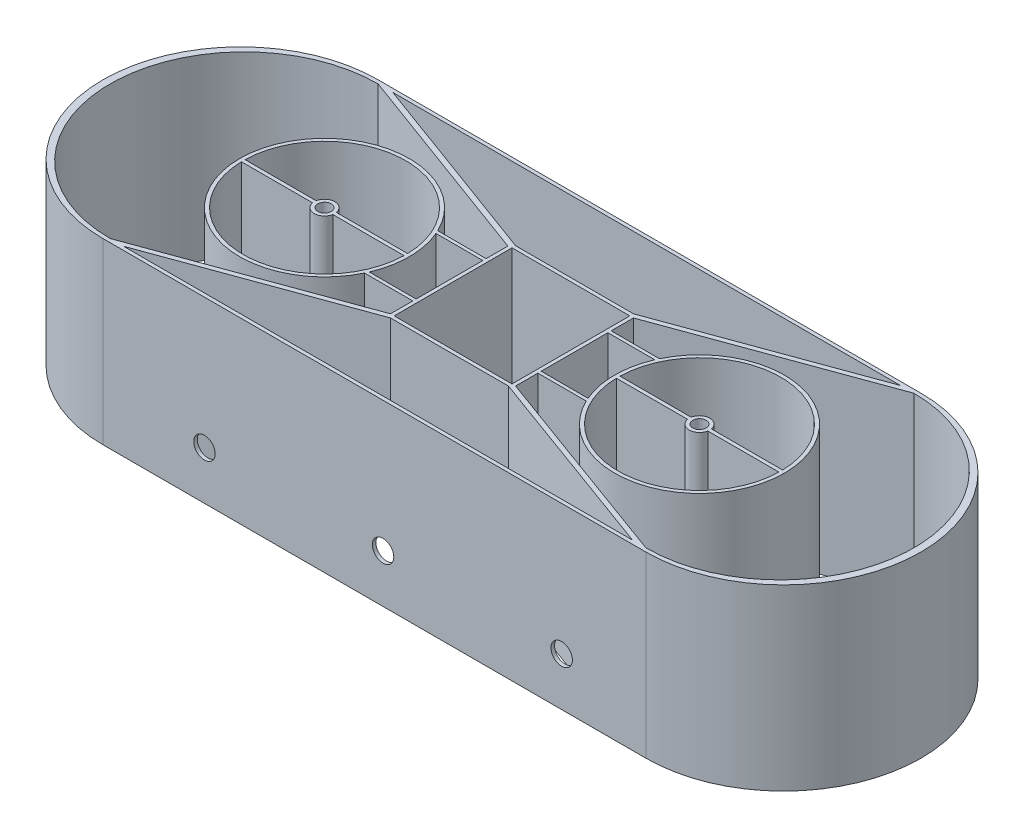
from build123d import *

# Parameters (mm, degrees)
SKETCH1_R           = 3.75
SKETCH1_W           = 66
SKETCH1_H           = 66
BOSS_EXTRUDE1_DEPTH = 100
SKETCH2_R           = 6
CUT_EXTRUDE1_DEPTH  = 10
SKETCH4_R           = 10.278687008
CUT_EXTRUDE2_DEPTH  = 10


with BuildPart() as part:
    # Sketch1 → Boss-Extrude1 (new body)
    with BuildSketch(Plane(origin=(0, 0, 0), x_dir=(1, 0, 0), z_dir=(0, 1, 0))):
        with BuildLine():
            Line((-152, 77), (152, 77))
            ThreePointArc((152, 77), (229, 0), (152, -77))
            Line((152, -77), (-152, -77))
            ThreePointArc((-152, -77), (-229, 0), (-152, 77))
        make_face()
        with Locations(Location((-104.964953983, 0, 0), (0, 0, 270))):
            Circle(SKETCH1_R, mode=Mode.SUBTRACT)
        with Locations(Location((104.964953983, 0, 0), (0, 0, 90))):
            Circle(SKETCH1_R, mode=Mode.SUBTRACT)
        Polygon((-141.697585802, 75), (142.523809524, 75), (33, 35), (-33, 35), align=None, mode=Mode.SUBTRACT)
        Polygon((-142.523809524, -75), (142.523809524, -75), (33, -35), (-33, -35), align=None, mode=Mode.SUBTRACT)
        with BuildLine():
            Line((-35, 32.680752833), (-150, 75))
            ThreePointArc((-150, 75), (-225, 0), (-150, -75))
            Line((-150, -75), (-35, -33))
            Line((-35, -33), (-35, -20.501152441))
            Line((-35, -20.501152441), (-62.070194122, -20.501152441))
            ThreePointArc((-62.070194122, -20.501152441), (-152.507121318, 0), (-62.070194122, 20.501152441))
            Line((-62.070194122, 20.501152441), (-35, 20.501152441))
            Line((-35, 20.501152441), (-35, 32.680752833))
        make_face(mode=Mode.SUBTRACT)
        with BuildLine():
            Line((35, 33), (35, 20.501152441))
            Line((35, 20.501152441), (62.070194122, 20.501152441))
            ThreePointArc((62.070194122, 20.501152441), (152.507121318, 0), (62.070194122, -20.501152441))
            Line((62.070194122, -20.501152441), (35, -20.501152441))
            Line((35, -20.501152441), (35, -33))
            Line((35, -33), (150, -75))
            ThreePointArc((150, -75), (225, 0), (150, 75))
            Line((150, 75), (35, 33))
        make_face(mode=Mode.SUBTRACT)
        Rectangle(SKETCH1_W, SKETCH1_H, mode=Mode.SUBTRACT)
        with BuildLine():
            Line((-61.249343804, 18.686976792), (-35, 18.686976792))
            Line((-35, 18.686976792), (-35, -18.686976792))
            Line((-35, -18.686976792), (-61.249343804, -18.686976792))
            ThreePointArc((-61.249343804, -18.686976792), (-57.422786648, 0), (-61.249343804, 18.686976792))
        make_face(mode=Mode.SUBTRACT)
        with BuildLine():
            Line((61.249343804, -18.686976792), (35, -18.686976792))
            Line((35, -18.686976792), (35, 18.686976792))
            Line((35, 18.686976792), (61.249343804, 18.686976792))
            ThreePointArc((61.249343804, 18.686976792), (57.422786648, 0), (61.249343804, -18.686976792))
        make_face(mode=Mode.SUBTRACT)
        with BuildLine():
            Line((-150.496141158, 1), (-110.630261894, 1))
            ThreePointArc((-110.630261894, 1), (-104.964953983, 5.752887425), (-99.299646072, 1))
            Line((-99.299646072, 1), (-59.433766808, 1))
            ThreePointArc((-59.433766808, 1), (-104.964953983, 45.542167335), (-150.496141158, 1))
        make_face(mode=Mode.SUBTRACT)
        with BuildLine():
            Line((-150.496141158, -1), (-110.630261894, -1))
            ThreePointArc((-110.630261894, -1), (-104.964953983, -5.752887425), (-99.299646072, -1))
            Line((-99.299646072, -1), (-59.433766808, -1))
            ThreePointArc((-59.433766808, -1), (-104.964953983, -45.542167335), (-150.496141158, -1))
        make_face(mode=Mode.SUBTRACT)
        with BuildLine():
            Line((59.433766808, 1), (99.299646072, 1))
            ThreePointArc((99.299646072, 1), (104.964953983, 5.752887425), (110.630261894, 1))
            Line((110.630261894, 1), (150.496141158, 1))
            ThreePointArc((150.496141158, 1), (104.964953983, 45.542167335), (59.433766808, 1))
        make_face(mode=Mode.SUBTRACT)
        with BuildLine():
            Line((59.433766808, -1), (99.299646072, -1))
            ThreePointArc((99.299646072, -1), (104.964953983, -5.752887425), (110.630261894, -1))
            Line((110.630261894, -1), (150.496141158, -1))
            ThreePointArc((150.496141158, -1), (104.964953983, -45.542167335), (59.433766808, -1))
        make_face(mode=Mode.SUBTRACT)
    extrude(amount=BOSS_EXTRUDE1_DEPTH)

    # Sketch2 → Cut-Extrude1 (cut)
    with BuildSketch(Plane.XY.offset(77)):
        with Locations((4.813758286, 27.006971007)):
            Circle(SKETCH2_R)
        with Locations((104.813758286, 27.006971007)):
            Circle(SKETCH2_R)
        with Locations((-95.186241714, 27.006971007)):
            Circle(SKETCH2_R)
    extrude(amount=-CUT_EXTRUDE1_DEPTH, mode=Mode.SUBTRACT)

    # Sketch4 → Cut-Extrude2 (cut)
    with BuildSketch(Plane(origin=(0, 0, -77), x_dir=(-1, 0, 0), z_dir=(0, 0, -1))):
        with Locations((0, 27.1)):
            Circle(SKETCH4_R)
        with Locations((100, 27.1)):
            Circle(SKETCH4_R)
        with Locations((-100, 27.1)):
            Circle(SKETCH4_R)
    extrude(amount=-CUT_EXTRUDE2_DEPTH, mode=Mode.SUBTRACT)


solid = part.part
